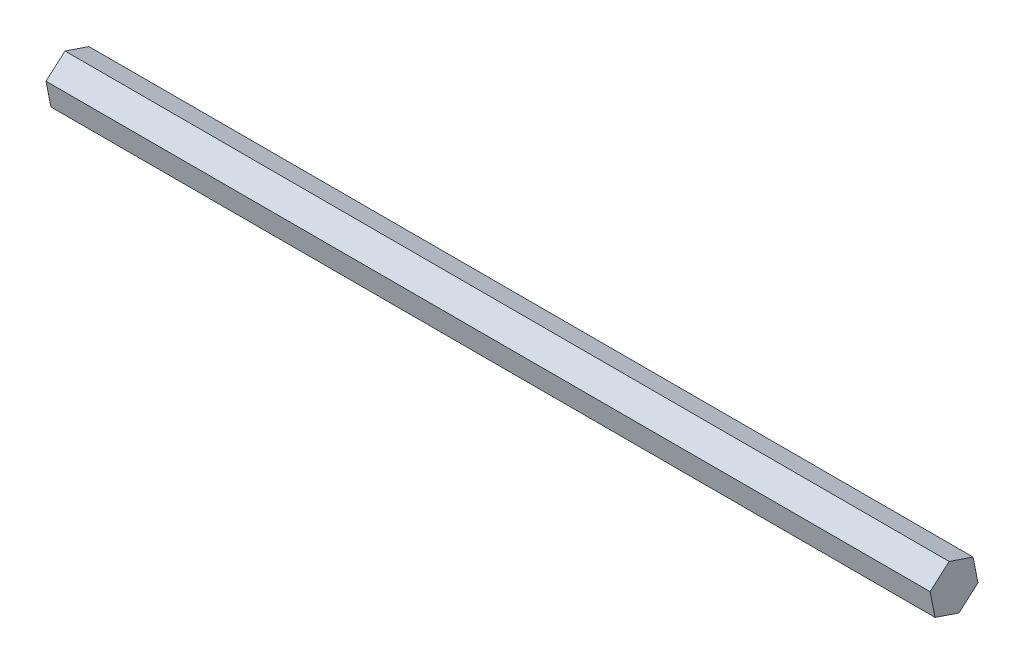
from build123d import *

# Parameters (mm, degrees)
BOSS_EXTRUDE1_DEPTH = 256.54


with BuildPart() as part:
    # Sketch3 → Boss-Extrude1 (new body)
    with BuildSketch(Plane(origin=(0, 0, 0), x_dir=(0, 0, -1), z_dir=(1, 0, 0))):
        Polygon((5.513473281, 4.83373), (-1.429396334, 7.191672924), (-6.942869615, 2.357942925), (-5.513473281, -4.83373), (1.429396334, -7.191672924), (6.942869615, -2.357942925), align=None)
    extrude(amount=BOSS_EXTRUDE1_DEPTH)


solid = part.part
